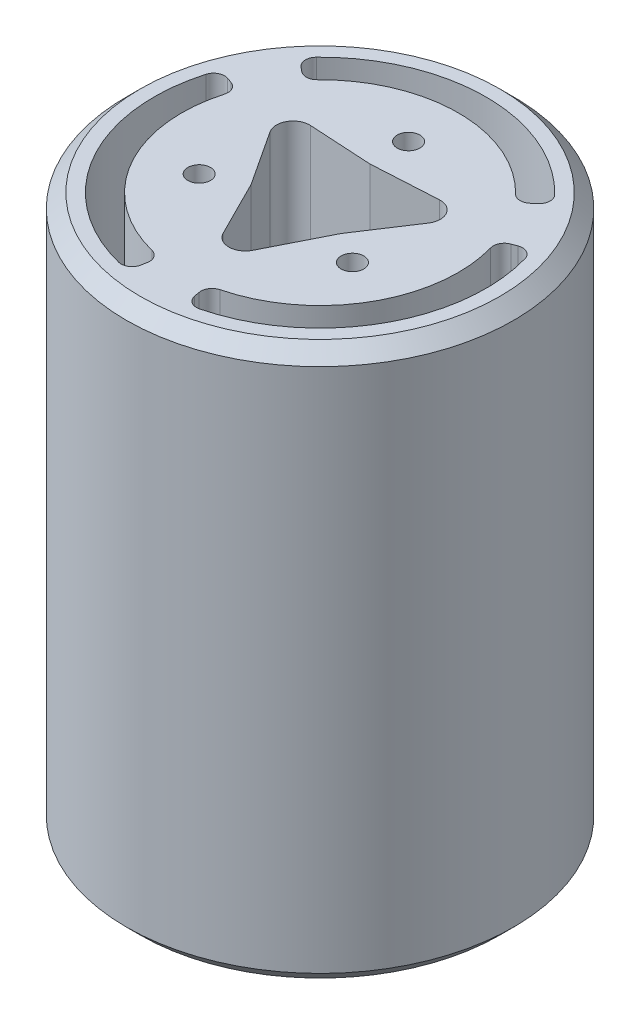
from build123d import *

# Parameters (mm, degrees)
SKETCH_1_R          = 35
EXTRUDE_1_DEPTH     = 100
SKETCH_2_R          = 2.05
CUT_EXTRUDE_1_DEPTH = 5
CHAMFER_1_SIZE      = 2.5
CUT_EXTRUDE_START   = -5
SKETCH_3_R          = 2.05
CUT_EXTRUDE_2_DEPTH = 5
CUT_EXTRUDE_3_DEPTH = 112.579568022


with BuildPart() as part:
    # ｽｹｯﾁ1 → ﾎﾞｽ - 押し出し1 (new body)
    with BuildSketch(Plane(origin=(0, 0, 0), x_dir=(1, 0, 0), z_dir=(0, 1, 0))):
        with Locations(Location((0, 0, 0), (0, 0, 270))):
            Circle(SKETCH_1_R)
    extrude(amount=EXTRUDE_1_DEPTH)

    # ｽｹｯﾁ2 → ｶｯﾄ - 押し出し1 (cut)
    with BuildSketch(Plane(origin=(0, 100, 0), x_dir=(1, 0, 0), z_dir=(0, 1, 0))):
        with Locations(Location((0, 16, 0), (0, 0, 270))):
            Circle(SKETCH_2_R)
        with Locations(Location((13.856406461, -8, 0), (0, 0, 270))):
            Circle(SKETCH_2_R)
        with Locations(Location((-13.856406461, -8, 0), (0, 0, 270))):
            Circle(SKETCH_2_R)
    extrude(amount=-CUT_EXTRUDE_1_DEPTH, mode=Mode.SUBTRACT)

    # 面取り1
    chamfer_1_edges = [part.edges().sort_by_distance(p)[0] for p in [
        (0, 0, -35),
        (0, 100, -35),
    ]]
    chamfer(chamfer_1_edges, length=CHAMFER_1_SIZE)

    # ｽｹｯﾁ3 → ｶｯﾄ - 押し出し2 (cut)
    with BuildSketch(Plane.XZ.offset(CUT_EXTRUDE_START)):
        with Locations(Location((0, -16, 0), (0, 0, 90))):
            Circle(SKETCH_3_R)
        with Locations(Location((-13.856406461, 8, 0), (0, 0, 90))):
            Circle(SKETCH_3_R)
        with Locations(Location((13.856406461, 8, 0), (0, 0, 90))):
            Circle(SKETCH_3_R)
    extrude(amount=CUT_EXTRUDE_2_DEPTH, mode=Mode.SUBTRACT)

    # ｽｹｯﾁ4 → ｶｯﾄ - 押し出し3 (cut, through all)
    with BuildSketch(Plane(origin=(0, 100, 0), x_dir=(1, 0, 0), z_dir=(0, 1, 0))):
        with BuildLine():
            Line((-21.394456976, 17.952080958), (-20.626377879, 17.307586071))
            ThreePointArc((-20.626377879, 17.307586071), (-19.240453869, 16.842194013), (-17.908150611, 17.444143479))
            ThreePointArc((-17.908150611, 17.444143479), (0, 25), (17.908150611, 17.444143479))
            ThreePointArc((17.908150611, 17.444143479), (19.240453869, 16.842194013), (20.626377879, 17.307586071))
            Line((20.626377879, 17.307586071), (21.394456976, 17.952080958))
            ThreePointArc((21.394456976, 17.952080958), (22.106227854, 19.38117195), (21.545230453, 20.875896261))
            ThreePointArc((21.545230453, 20.875896261), (0, 30), (-21.545230453, 20.875896261))
            ThreePointArc((-21.545230453, 20.875896261), (-22.106227854, 19.38117195), (-21.394456976, 17.952080958))
        make_face()
        with BuildLine():
            Line((4.849729672, -27.50418372), (4.675620276, -26.516760267))
            ThreePointArc((4.675620276, -26.516760267), (4.965540937, -25.083818837), (6.152996094, -24.230985103))
            ThreePointArc((6.152996094, -24.230985103), (21.650635095, -12.5), (24.061146705, 6.786841624))
            ThreePointArc((24.061146705, 6.786841624), (24.205994805, 8.241624824), (25.301998155, 9.209174196))
            Line((25.301998155, 9.209174196), (26.244186648, 9.552102762))
            ThreePointArc((26.244186648, 9.552102762), (27.837701191, 9.453968928), (28.851671716, 8.220768772))
            ThreePointArc((28.851671716, 8.220768772), (25.980762114, -15), (7.306441262, -29.096665034))
            ThreePointArc((7.306441262, -29.096665034), (5.731473337, -28.835140879), (4.849729672, -27.50418372))
        make_face()
        with BuildLine():
            Line((-26.244186648, 9.552102762), (-25.301998155, 9.209174196))
            ThreePointArc((-25.301998155, 9.209174196), (-24.205994805, 8.241624824), (-24.061146705, 6.786841624))
            ThreePointArc((-24.061146705, 6.786841624), (-21.650635095, -12.5), (-6.152996094, -24.230985103))
            ThreePointArc((-6.152996094, -24.230985103), (-4.965540937, -25.083818837), (-4.675620276, -26.516760267))
            Line((-4.675620276, -26.516760267), (-4.849729672, -27.50418372))
            ThreePointArc((-4.849729672, -27.50418372), (-5.731473337, -28.835140879), (-7.306441262, -29.096665034))
            ThreePointArc((-7.306441262, -29.096665034), (-25.980762114, -15), (-28.851671716, 8.220768772))
            ThreePointArc((-28.851671716, 8.220768772), (-27.837701191, 9.453968928), (-26.244186648, 9.552102762))
        make_face()
        with BuildLine():
            Line((-7.526031383, -4.935468734), (-14.052277383, 5.016317986))
            ThreePointArc((-14.052277383, 5.016317986), (-14.141048063, 8.162562133), (-11.37068313, 9.656486697))
            Line((-11.37068313, 9.656486697), (0, 9))
            Line((0, 9), (11.881623113, 9.676001467))
            ThreePointArc((11.881623113, 9.676001467), (14.65073581, 8.179757058), (14.559329968, 5.033588367))
            Line((14.559329968, 5.033588367), (8.305454246, -4.485468734))
            Line((8.305454246, -4.485468734), (2.950077133, -15.113256922))
            ThreePointArc((2.950077133, -15.113256922), (0.269735116, -16.763256659), (-2.409223974, -15.111012532))
            Line((-2.409223974, -15.111012532), (-7.526031383, -4.935468734))
        make_face()
    extrude(amount=-CUT_EXTRUDE_3_DEPTH, mode=Mode.SUBTRACT)


solid = part.part
